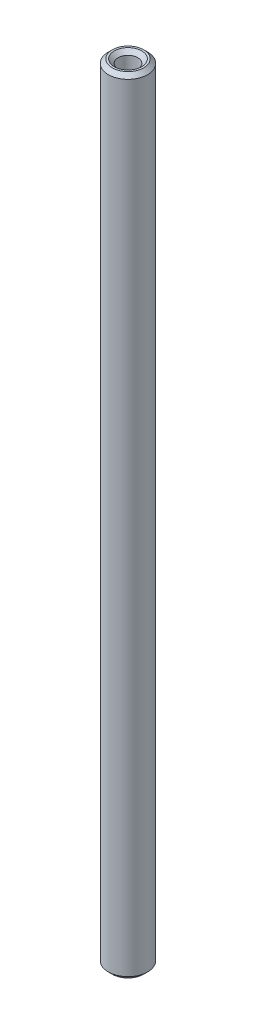
from build123d import *

# Parameters (mm, degrees)
SKETCH1_R      = 2.5
SKETCH1_R_2    = 1.25
EXTRUDE1_DEPTH = 50
CHAMFER1_SIZE  = 0.5


with BuildPart() as part:
    # Sketch1 → Extrude1 (new, symmetric)
    with BuildSketch(Plane(origin=(0, 0, 0), x_dir=(1, 0, 0), z_dir=(0, 1, 0))):
        with Locations(Location((0, 0, 0), (0, 0, 270))):
            Circle(SKETCH1_R)
        with Locations(Location((0, 0, 0), (0, 0, 270))):
            Circle(SKETCH1_R_2, mode=Mode.SUBTRACT)
    extrude(amount=EXTRUDE1_DEPTH, both=True)

    # Chamfer1
    chamfer1_edges = [part.edges().sort_by_distance(p)[0] for p in [
        (0, -50, -2.5),
        (0, 50, -2.5),
        (0, -50, -1.25),
        (0, 50, -1.25),
    ]]
    chamfer(chamfer1_edges, length=CHAMFER1_SIZE)


solid = part.part
